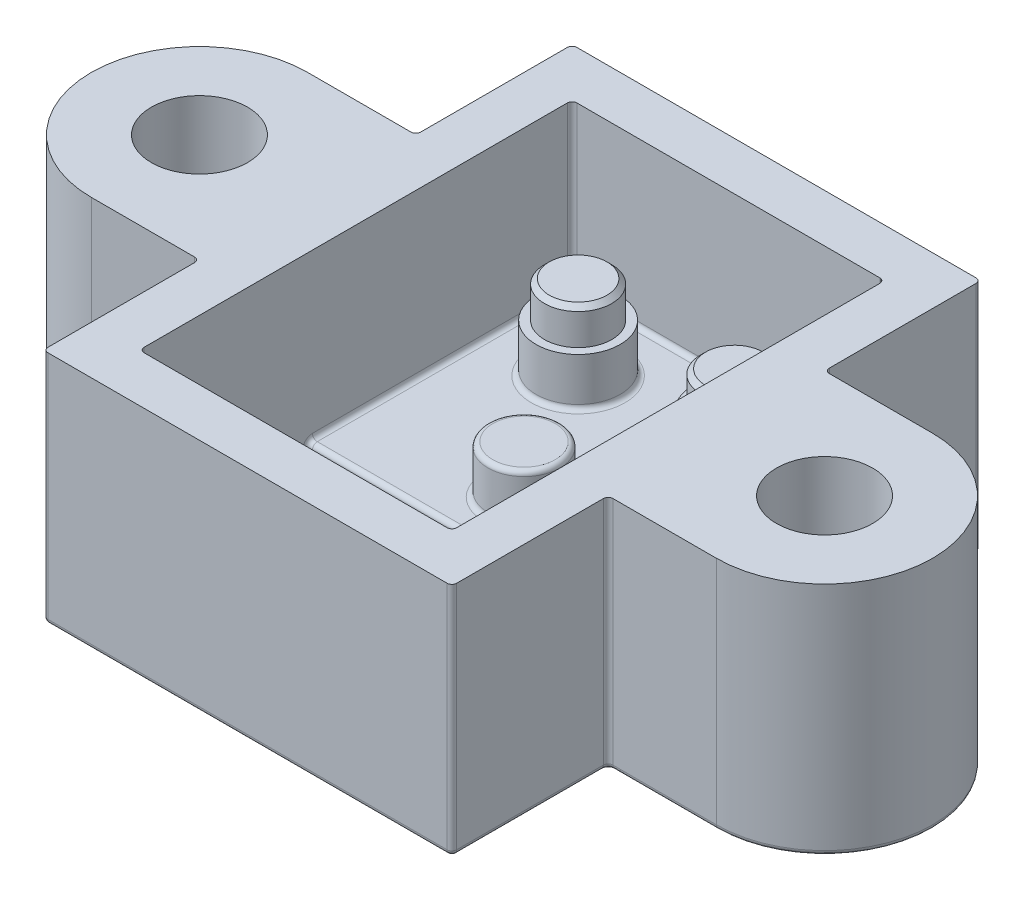
from build123d import *

# Parameters (mm, degrees)
SKETCH1_W           = 17
SKETCH1_H           = 22
SKETCH1_W_2         = 13
SKETCH1_H_2         = 18
BOSS_EXTRUDE1_DEPTH = 6.8
SKETCH2_W           = 17
SKETCH2_H           = 22
BOSS_EXTRUDE2_DEPTH = 3
SKETCH5_W           = 13
SKETCH5_H           = 7
CUT_EXTRUDE1_DEPTH  = 16.475464452
SKETCH6_R           = 1.5
BOSS_EXTRUDE3_DEPTH = 2
SKETCH7_R           = 2
BOSS_EXTRUDE4_DEPTH = 9.8
CHAMFER1_SIZE       = 2
FILLET1_R           = 0.2


with BuildPart() as part:
    # Sketch1 → Boss-Extrude1 (new body)
    with BuildSketch(Plane(origin=(0, 0, 0), x_dir=(1, 0, 0), z_dir=(0, 1, 0))):
        Rectangle(SKETCH1_W, SKETCH1_H)
        Rectangle(SKETCH1_W_2, SKETCH1_H_2, mode=Mode.SUBTRACT)
    extrude(amount=BOSS_EXTRUDE1_DEPTH)

    # Sketch2 → Boss-Extrude2 (add)
    with BuildSketch(Plane.XZ):
        Rectangle(SKETCH2_W, SKETCH2_H)
    extrude(amount=BOSS_EXTRUDE2_DEPTH)

    # Sketch4 → Revolve1 (revolve)
    with BuildSketch(Plane.XY.offset(-6), mode=Mode.PRIVATE) as revolve1_sk:
        Polygon((-3.25, 0), (-3.25, 3.5), (-4.45, 3.5), (-4.65, 3.3), (-4.65, 2), (-5, 2), (-5, 0), align=None)
    revolve1 = revolve(revolve1_sk.sketch.rotate(Axis((-3.25, 0, -6), (0, 1, 0)), 270), axis=Axis((-3.25, 0, -6), (0, 1, 0)))

    # Mirror1: Revolve1 across plane
    add(revolve1.mirror(Plane(origin=(0, 0, 0), x_dir=(0, 0, 1), z_dir=(1, 0, 0))))

    # Sketch5 → Cut-Extrude1 (cut, through all)
    with BuildSketch(Plane(origin=(0, 0, 0), x_dir=(1, 0, 0), z_dir=(0, 1, 0))):
        with Locations((0, -5.5)):
            Rectangle(SKETCH5_W, SKETCH5_H)
    extrude(amount=-CUT_EXTRUDE1_DEPTH, mode=Mode.SUBTRACT)

    # Sketch6 → Boss-Extrude3 (add)
    with BuildSketch(Plane(origin=(0, 0, 0), x_dir=(1, 0, 0), z_dir=(0, 1, 0))):
        with Locations(Location((0, 0.5, 0), (0, 0, 90))):
            Circle(SKETCH6_R)
    extrude(amount=BOSS_EXTRUDE3_DEPTH)

    # Sketch7 → Boss-Extrude4 (add)
    with BuildSketch(Plane.XZ.offset(3)):
        with BuildLine():
            Line((-8.5, 4.5), (-13, 4.5))
            ThreePointArc((-13, 4.5), (-17.5, 0), (-13, -4.5))
            Line((-13, -4.5), (-8.5, -4.5))
            Line((-8.5, -4.5), (-8.5, 4.5))
        make_face()
        with Locations(Location((-13, 0, 0), (0, 0, 270))):
            Circle(SKETCH7_R, mode=Mode.SUBTRACT)
    boss_extrude4 = extrude(amount=-BOSS_EXTRUDE4_DEPTH)

    # Mirror2: Boss-Extrude4 across plane
    add(boss_extrude4.mirror(Plane(origin=(0, 0, 0), x_dir=(0, 0, 1), z_dir=(1, 0, 0))))

    # Chamfer1
    chamfer1_edges = [part.edges().sort_by_distance(p)[0] for p in [
        (13, -3, 2),
        (-13, -3, 2),
    ]]
    chamfer(chamfer1_edges, length=CHAMFER1_SIZE)

    # Fillet1
    fillet1_edges = [part.edges().sort_by_distance(p)[0] for p in [
        (13, -3, 4),
        (-13, -3, 4),
        (6.5, 1.9, 9),
        (0, 0, -9),
        (6.5, 3.4, -9),
        (-6.5, 0, -3.5),
        (-6.5, 3.4, -9),
        (-6.5, 1.9, 9),
        (-8.5, -3, 7.75),
        (0, -3, -11),
        (8.5, -3, -7.75),
        (0, -3, 11),
        (-3.25, 0, -4.25),
        (3.25, 0, -4.25),
        (6.5, 0, -3.5),
        (6.5, -3, 5.5),
        (6.5, -1.5, 2),
        (0, -3, 9),
        (-6.5, -3, 5.5),
        (0, -3, 2),
        (-6.5, -1.5, 2),
        (0, 0, 2),
        (0, 0, 1),
        (0, 2, 1),
        (-8.5, 1.9, 11),
        (-8.5, 1.9, -11),
        (8.5, 1.9, -11),
        (-8.5, -3, -7.75),
        (8.5, 1.9, 11),
        (-8.5, 1.9, 4.5),
        (-8.5, 1.9, -4.5),
        (-10.75, -3, 4.5),
        (-17.5, -3, 0),
        (-10.75, -3, -4.5),
        (8.5, -3, 7.75),
        (10.75, -3, -4.5),
        (17.5, -3, 0),
        (8.5, 1.9, 4.5),
        (10.75, -3, 4.5),
        (8.5, 1.9, -4.5),
    ]]
    fillet(fillet1_edges, radius=FILLET1_R)


solid = part.part
